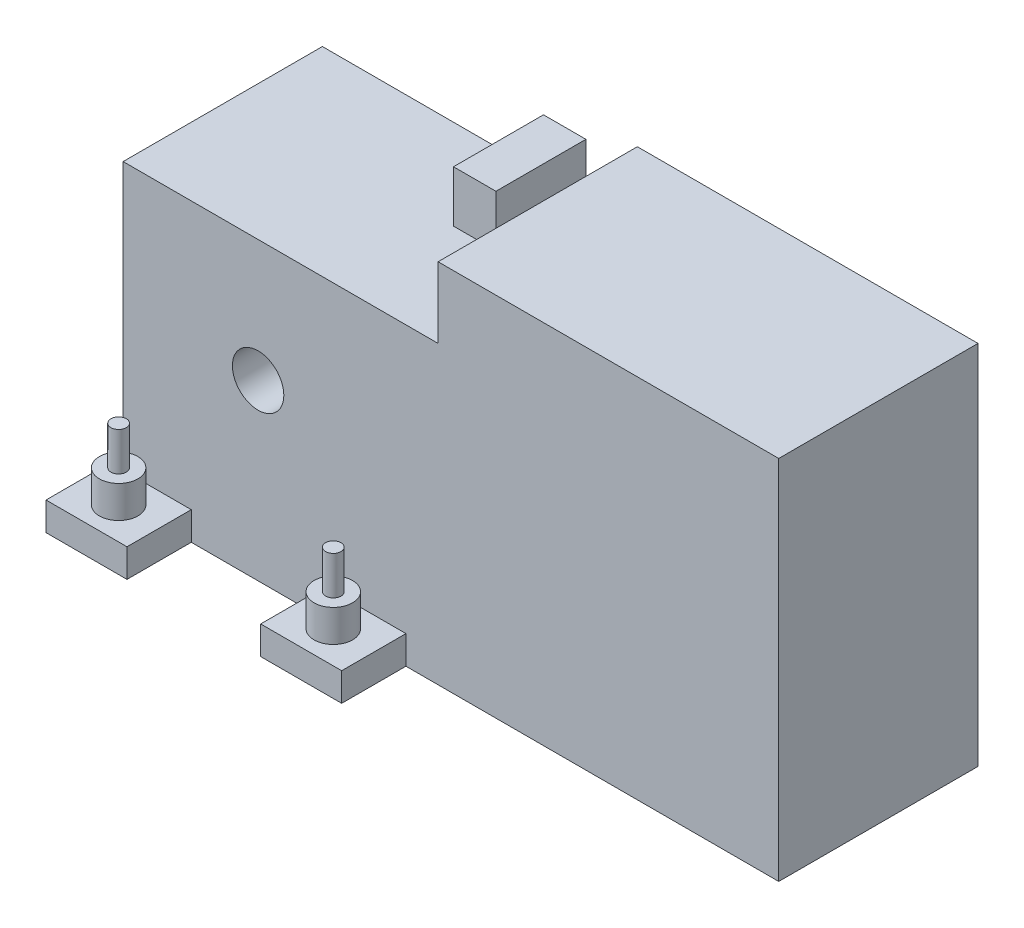
from build123d import *
from build123d.topology import SkipClean

# Parameters (mm, degrees)
SKETCH2_R           = 85
SKETCH2_R_2         = 20
BOSS_EXTRUDE1_DEPTH = 5
BOSS_EXTRUDE2_START = 155
SKETCH3_W           = 245
SKETCH3_H           = 230
SKETCH3_R           = 85
SKETCH3_W_2         = 265
SKETCH3_H_2         = 285
SKETCH3_R_2         = 20
BOSS_EXTRUDE2_DEPTH = 155
SKETCH4_W           = 33
SKETCH4_H           = 40
BOSS_EXTRUDE4_DEPTH = 70
SKETCH6_R           = 15
SKETCH6_W           = 63
SKETCH6_H           = 50
BOSS_EXTRUDE6_DEPTH = 22
SKETCH6_3_R         = 15
SKETCH6_3_R_2       = 6
BOSS_EXTRUDE7_DEPTH = 47
SKETCH6_4_R         = 6
BOSS_EXTRUDE8_DEPTH = 77
SKETCH2_4_R         = 85
CUT_EXTRUDE2_DEPTH  = 5


with BuildPart() as part:
    # Sketch2 → Boss-Extrude1 (new body)
    with BuildSketch(Plane.XY):
        Circle(SKETCH2_R)
        Circle(SKETCH2_R_2, mode=Mode.SUBTRACT)
    extrude(amount=BOSS_EXTRUDE1_DEPTH)

    # Sketch3 → Boss-Extrude2 (add)
    # profile 1 of 3: a face of its own
    with SkipClean():  # the faces are left unmerged after this step: merging them gives an invalid solid
        with BuildSketch(Plane(origin=(0, 0, 0), x_dir=(-1, 0, 0), z_dir=(0, 0, -1)).offset(BOSS_EXTRUDE2_START)):
            with Locations((-17.5, -20)):
                Rectangle(SKETCH3_W, SKETCH3_H)
            with Locations(Location((0, 0, 0), (0, 0, 180))):
                Circle(SKETCH3_R, mode=Mode.SUBTRACT)
        # profile 2 of 3: a face of its own
        with BuildSketch(Plane(origin=(0, 0, 0), x_dir=(-1, 0, 0), z_dir=(0, 0, -1)).offset(BOSS_EXTRUDE2_START)):
            with Locations((-272.5, 7.5)):
                Rectangle(SKETCH3_W_2, SKETCH3_H_2)
        # profile 3 of 3: a face of its own
        with BuildSketch(Plane(origin=(0, 0, 0), x_dir=(-1, 0, 0), z_dir=(0, 0, -1)).offset(BOSS_EXTRUDE2_START)):
            with Locations(Location((0, 0, 0), (0, 0, 180))):
                Circle(SKETCH3_R)
            Circle(SKETCH3_R_2, mode=Mode.SUBTRACT)
        extrude(amount=-BOSS_EXTRUDE2_DEPTH)

    # Sketch4 → Boss-Extrude4 (add)
    with SkipClean():  # the faces are left unmerged after this step: merging them gives an invalid solid
        with BuildSketch(Plane(origin=(0, 0, -155), x_dir=(-1, 0, 0), z_dir=(0, 0, -1))):
            with Locations((-83.5, 115)):
                Rectangle(SKETCH4_W, SKETCH4_H)
        extrude(amount=-BOSS_EXTRUDE4_DEPTH)

    # Sketch6 → Boss-Extrude6 (add)
    # profile 1 of 2: a face of its own
    with SkipClean():  # the faces are left unmerged after this step: merging them gives an invalid solid
        with BuildSketch(Plane.XZ.offset(135)):
            Polygon((-115, 50), (-115, 0), (-105, 0), (-52, 0), (-52, 50), align=None)
            with Locations(Location((-83.5, 25, 0), (0, 0, 270))):
                Circle(SKETCH6_R, mode=Mode.SUBTRACT)
        # profile 2 of 2: a face of its own
        with BuildSketch(Plane.XZ.offset(135)):
            with Locations((83.5, 25)):
                Rectangle(SKETCH6_W, SKETCH6_H)
            with Locations(Location((83.5, 25, 0), (0, 0, 270))):
                Circle(SKETCH6_R, mode=Mode.SUBTRACT)
        extrude(amount=-BOSS_EXTRUDE6_DEPTH)

    # Sketch6<3> → Boss-Extrude7 (add)
    # profile 1 of 2: a face of its own
    with SkipClean():  # the faces are left unmerged after this step: merging them gives an invalid solid
        with BuildSketch(Plane.XZ.offset(135)):
            with Locations(Location((-83.5, 25, 0), (0, 0, 270))):
                Circle(SKETCH6_3_R)
            with Locations(Location((-83.5, 25, 0), (0, 0, 270))):
                Circle(SKETCH6_3_R_2, mode=Mode.SUBTRACT)
        # profile 2 of 2: a face of its own
        with BuildSketch(Plane.XZ.offset(135)):
            with Locations(Location((83.5, 25, 0), (0, 0, 270))):
                Circle(SKETCH6_3_R)
            with Locations(Location((83.5, 25, 0), (0, 0, 270))):
                Circle(SKETCH6_3_R_2, mode=Mode.SUBTRACT)
        extrude(amount=-BOSS_EXTRUDE7_DEPTH)

    # Sketch6<4> → Boss-Extrude8 (add)
    with SkipClean():  # the faces are left unmerged after this step: merging them gives an invalid solid
        with BuildSketch(Plane.XZ.offset(135)):
            with Locations(Location((-83.5, 25, 0), (0, 0, 270))):
                Circle(SKETCH6_4_R)
            with Locations(Location((83.5, 25, 0), (0, 0, 270))):
                Circle(SKETCH6_4_R)
        extrude(amount=-BOSS_EXTRUDE8_DEPTH)

    # Sketch2<4> → Cut-Extrude2 (cut)
    with BuildSketch(Plane.XY):
        Circle(SKETCH2_4_R)
    extrude(amount=CUT_EXTRUDE2_DEPTH, mode=Mode.SUBTRACT)


solid = part.part
